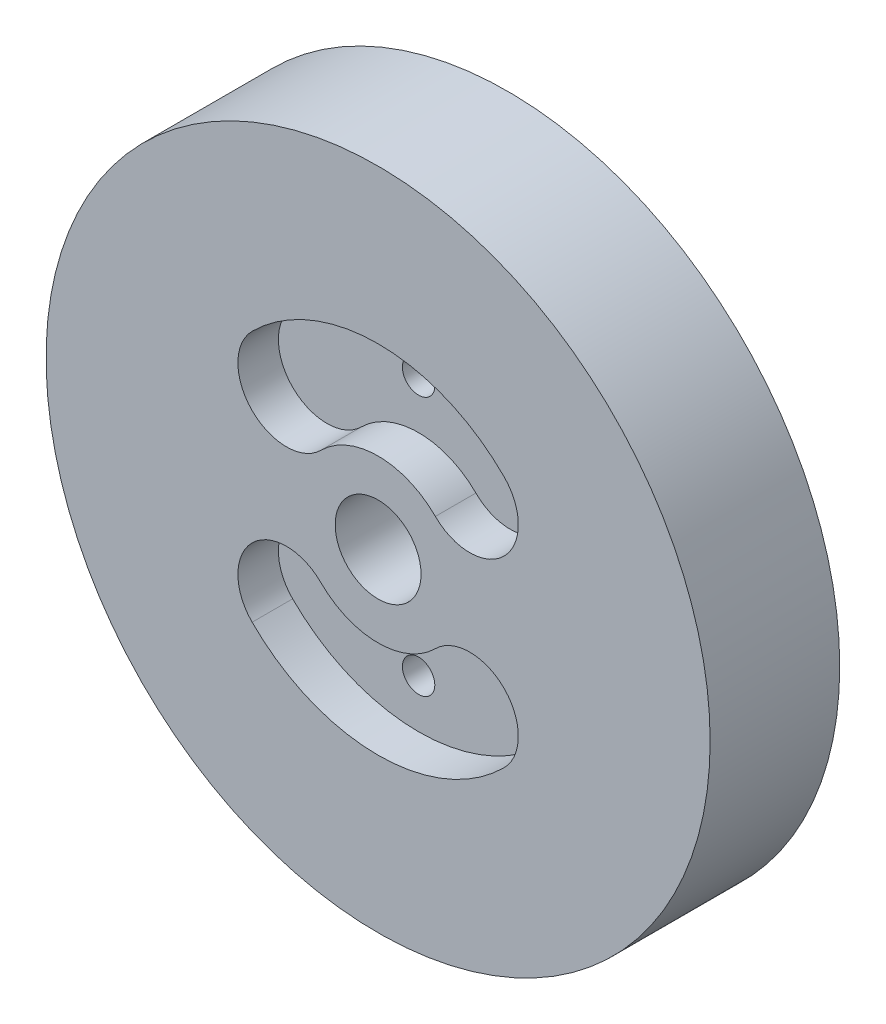
from build123d import *

# Parameters (mm, degrees)
SKETCH_1_R               = 20.5
EXTRUDE_1_DEPTH          = 8
CUT_EXTRUDE_1_DEPTH      = 31.074906484
CUT_EXTRUDE_1_DEPTH_BACK = 31.074906484
SKETCH_1_3_R             = 2.65
SKETCH_9_R               = 1
CUT_EXTRUDE_2_DEPTH      = 2.5
SKETCH_9_3_R             = 1
CUT_EXTRUDE_3_DEPTH      = 31.074906484
SKETCH_12_R              = 2.65
CUT_EXTRUDE_4_DEPTH      = 5


with BuildPart() as part:
    # 스케치1 → 보스-돌출1 (new body)
    with BuildSketch(Plane.XY):
        Circle(SKETCH_1_R)
    extrude(amount=EXTRUDE_1_DEPTH)

    # 스케치1<3> → 컷-돌출1 (cut, two sides: drawn at the far end of the back side and taken through both)
    with BuildSketch(Plane.XY.offset(-CUT_EXTRUDE_1_DEPTH_BACK)):
        Circle(SKETCH_1_3_R)
    extrude(amount=CUT_EXTRUDE_1_DEPTH + CUT_EXTRUDE_1_DEPTH_BACK, mode=Mode.SUBTRACT)

    # 스케치9 → 컷-돌출2 (cut)
    # profile 1 of 2: a face of its own
    with BuildSketch(Plane.XY.offset(8)):
        with BuildLine():
            ThreePointArc((3.535533906, 3.535533906), (7.778174593, 3.535533906), (7.778174593, 7.778174593))
            ThreePointArc((7.778174593, 7.778174593), (0, 11), (-7.778174593, 7.778174593))
            ThreePointArc((-7.778174593, 7.778174593), (-7.778174593, 3.535533906), (-3.535533906, 3.535533906))
            ThreePointArc((-3.535533906, 3.535533906), (0, 5), (3.535533906, 3.535533906))
        make_face()
        with Locations((0, 8)):
            Circle(SKETCH_9_R, mode=Mode.SUBTRACT)
    # profile 2 of 2: a face of its own
    with BuildSketch(Plane.XY.offset(8)):
        with BuildLine():
            ThreePointArc((-7.778174593, -7.778174593), (0, -11), (7.778174593, -7.778174593))
            ThreePointArc((7.778174593, -7.778174593), (7.778174593, -3.535533906), (3.535533906, -3.535533906))
            ThreePointArc((3.535533906, -3.535533906), (0, -5), (-3.535533906, -3.535533906))
            ThreePointArc((-3.535533906, -3.535533906), (-7.778174593, -3.535533906), (-7.778174593, -7.778174593))
        make_face()
        with Locations((0, -8)):
            Circle(SKETCH_9_R, mode=Mode.SUBTRACT)
    extrude(amount=-CUT_EXTRUDE_2_DEPTH, mode=Mode.SUBTRACT)

    # 스케치9<3> → 컷-돌출3 (cut, through all)
    with BuildSketch(Plane.XY.offset(8)):
        with Locations((0, 8)):
            Circle(SKETCH_9_3_R)
        with Locations((0, -8)):
            Circle(SKETCH_9_3_R)
    extrude(amount=-CUT_EXTRUDE_3_DEPTH, mode=Mode.SUBTRACT)

    # 스케치12 → 컷-돌출4 (cut)
    with BuildSketch(Plane(origin=(0, 0, 0), x_dir=(-1, 0, 0), z_dir=(0, 0, -1))):
        with Locations((-12.5, 0)):
            Circle(SKETCH_12_R)
        with Locations((12.5, 0)):
            Circle(SKETCH_12_R)
    extrude(amount=-CUT_EXTRUDE_4_DEPTH, mode=Mode.SUBTRACT)


solid = part.part
